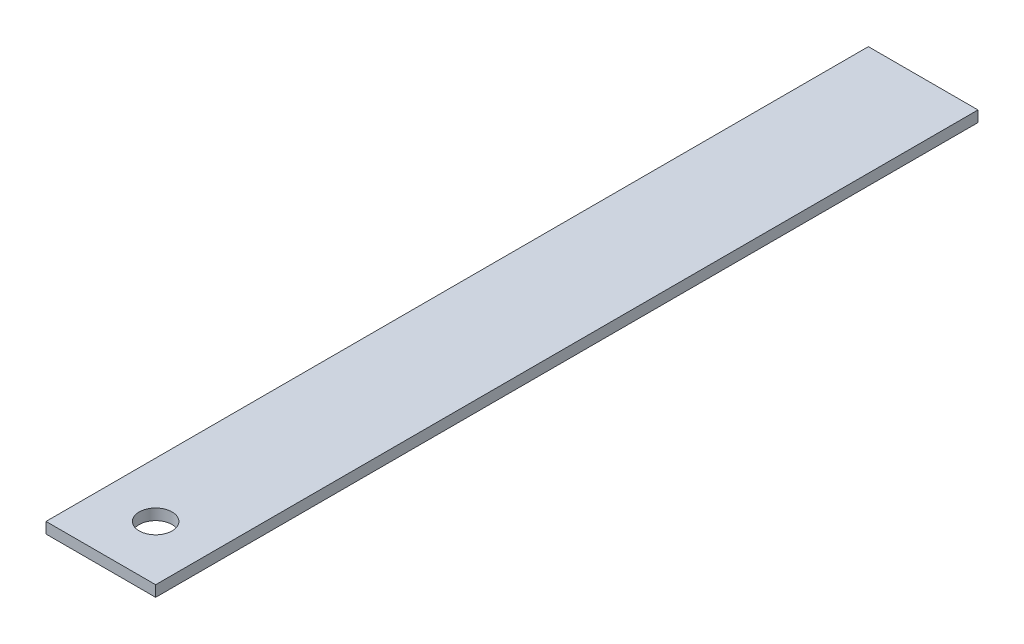
from build123d import *

# Parameters (mm, degrees)
SKETCH1_W           = 20
SKETCH1_H           = 150
SKETCH1_R           = 3
BOSS_EXTRUDE1_DEPTH = 2


with BuildPart() as part:
    # Sketch1 → Boss-Extrude1 (new body)
    with BuildSketch(Plane(origin=(0, 0, 0), x_dir=(1, 0, 0), z_dir=(0, 1, 0))):
        Rectangle(SKETCH1_W, SKETCH1_H)
        with Locations(Location((0, -65, 0), (0, 0, 270))):
            Circle(SKETCH1_R, mode=Mode.SUBTRACT)
    extrude(amount=BOSS_EXTRUDE1_DEPTH)


solid = part.part
